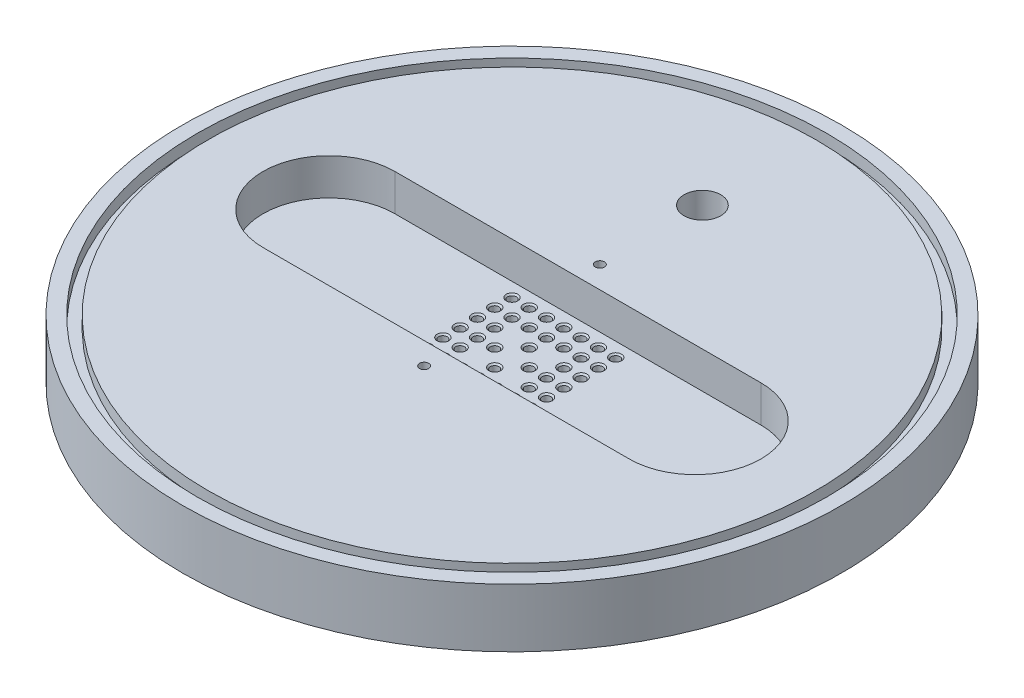
from build123d import *

# Parameters (mm, degrees)
SKETCH1_R                               = 57.15
BILLET_DEPTH                            = 10.16
KEROSENE_WELL_DEPTH                     = 6.35
FIRST_KEROSENE_OUTLET_REACH             = 83.458
SKETCH4_R                               = 0.7493
BOTTOM_NEEDLE_CHAMFER_SIZE              = 0.254
LPATTERN1_COUNT                         = 7
LPATTERN1_PITCH                         = 2.9972
LPATTERN1_COUNT_DIR2                    = 7
LPATTERN1_PITCH_DIR2                    = 2.9972
BOTTOM_NEEDLE_CHAMFER_OF_LPATTERN1_SIZE = 0.254
SKETCH13_R                              = 0.79375
DOWEL_HOLES_DEPTH                       = 3.175
MANIFOLD_HOLE_REACH                     = 83.458
SKETCH14_R                              = 3.175
SKETCH15_R                              = 56.515
SKETCH15_R_2                            = 54.61
CHAMBER_O_RING_DEPTH                    = 2.032
CUT_EXTRUDE4_START                      = -2.032
SKETCH16_R                              = 54.61
SKETCH16_R_2                            = 52.705
CUT_EXTRUDE4_DEPTH                      = 2.032


with BuildPart() as part:
    # Sketch1 → Billet (new body)
    with BuildSketch(Plane(origin=(0, 0, 0), x_dir=(1, 0, 0), z_dir=(0, 1, 0))):
        Circle(SKETCH1_R)
    extrude(amount=-BILLET_DEPTH)

    # Sketch2 → Kerosene Well (cut)
    with BuildSketch(Plane(origin=(0, 0, 0), x_dir=(1, 0, 0), z_dir=(0, 1, 0))):
        with BuildLine():
            Line((-31.75, 11.43), (31.75, 11.43))
            ThreePointArc((31.75, 11.43), (43.18, 0), (31.75, -11.43))
            Line((31.75, -11.43), (-31.75, -11.43))
            ThreePointArc((-31.75, -11.43), (-43.18, 0), (-31.75, 11.43))
        make_face()
    extrude(amount=-KEROSENE_WELL_DEPTH, mode=Mode.SUBTRACT)

    # Sketch4 → First Kerosene Outlet (cut, up to next)
    with BuildSketch(Plane(origin=(0, -10.16, 0), x_dir=(1, 0, 0), z_dir=(0, 1, 0)), mode=Mode.PRIVATE) as first_kerosene_outlet_sk1:
        with Locations((8.9916, 8.9916)):
            Circle(SKETCH4_R)
    first_kerosene_outlet_tool1 = extrude(first_kerosene_outlet_sk1.sketch, amount=FIRST_KEROSENE_OUTLET_REACH, mode=Mode.PRIVATE) & part.part
    first_kerosene_outlet = first_kerosene_outlet_tool1.solids().sort_by_distance((8.9916, -10.16, -8.9916))[0]
    add(first_kerosene_outlet, mode=Mode.SUBTRACT)

    # Bottom Needle Chamfer
    bottom_needle_chamfer_edges = [part.edges().sort_by_distance(p)[0] for p in [
        (8.2423, -6.35, -8.9916),
    ]]
    chamfer(bottom_needle_chamfer_edges, length=BOTTOM_NEEDLE_CHAMFER_SIZE)

    # LPattern1: First Kerosene Outlet 7 × 7, 5 skipped
    with Locations(*[(-j * LPATTERN1_PITCH_DIR2, 0, i * LPATTERN1_PITCH) for i in range(LPATTERN1_COUNT) for j in range(LPATTERN1_COUNT_DIR2) if (i, j) not in ((0, 0), (2, 2), (2, 4), (3, 3), (4, 2), (4, 4))]):
        add(first_kerosene_outlet, mode=Mode.SUBTRACT)

    # Bottom Needle Chamfer of LPattern1
    bottom_needle_chamfer_of_lpattern1_edges = [part.edges().sort_by_distance(p)[0] for p in [
        (5.2451, -6.35, -8.9916),
        (2.2479, -6.35, -8.9916),
        (-0.7493, -6.35, -8.9916),
        (-3.7465, -6.35, -8.9916),
        (-6.7437, -6.35, -8.9916),
        (-9.7409, -6.35, -8.9916),
        (8.2423, -6.35, -5.9944),
        (5.2451, -6.35, -5.9944),
        (2.2479, -6.35, -5.9944),
        (-0.7493, -6.35, -5.9944),
        (-3.7465, -6.35, -5.9944),
        (-6.7437, -6.35, -5.9944),
        (-9.7409, -6.35, -5.9944),
        (8.2423, -6.35, -2.9972),
        (5.2451, -6.35, -2.9972),
        (-0.7493, -6.35, -2.9972),
        (-6.7437, -6.35, -2.9972),
        (-9.7409, -6.35, -2.9972),
        (8.2423, -6.35, 0),
        (5.2451, -6.35, 0),
        (2.2479, -6.35, 0),
        (-3.7465, -6.35, 0),
        (-6.7437, -6.35, 0),
        (-9.7409, -6.35, 0),
        (8.2423, -6.35, 2.9972),
        (5.2451, -6.35, 2.9972),
        (-0.7493, -6.35, 2.9972),
        (-6.7437, -6.35, 2.9972),
        (-9.7409, -6.35, 2.9972),
        (8.2423, -6.35, 5.9944),
        (5.2451, -6.35, 5.9944),
        (2.2479, -6.35, 5.9944),
        (-0.7493, -6.35, 5.9944),
        (-3.7465, -6.35, 5.9944),
        (-6.7437, -6.35, 5.9944),
        (-9.7409, -6.35, 5.9944),
        (8.2423, -6.35, 8.9916),
        (5.2451, -6.35, 8.9916),
        (2.2479, -6.35, 8.9916),
        (-0.7493, -6.35, 8.9916),
        (-3.7465, -6.35, 8.9916),
        (-6.7437, -6.35, 8.9916),
        (-9.7409, -6.35, 8.9916),
    ]]
    chamfer(bottom_needle_chamfer_of_lpattern1_edges, length=BOTTOM_NEEDLE_CHAMFER_OF_LPATTERN1_SIZE)

    # Sketch13 → Dowel Holes (cut)
    with BuildSketch(Plane(origin=(0, 0, 0), x_dir=(1, 0, 0), z_dir=(0, 1, 0))):
        with Locations((0, 15.24)):
            Circle(SKETCH13_R)
        with Locations((0, -15.24)):
            Circle(SKETCH13_R)
    extrude(amount=-DOWEL_HOLES_DEPTH, mode=Mode.SUBTRACT)

    # Sketch14 → Manifold Hole (cut, up to next)
    with BuildSketch(Plane(origin=(0, 0, 0), x_dir=(1, 0, 0), z_dir=(0, 1, 0)), mode=Mode.PRIVATE) as manifold_hole_sk1:
        with Locations((0, 33.02)):
            Circle(SKETCH14_R)
    manifold_hole_tool1 = extrude(manifold_hole_sk1.sketch, amount=-MANIFOLD_HOLE_REACH, mode=Mode.PRIVATE) & part.part
    add(manifold_hole_tool1.solids().sort_by_distance((0, 0, -33.02))[0], mode=Mode.SUBTRACT)

    # Sketch15 → Chamber O Ring (cut)
    with BuildSketch(Plane(origin=(0, -10.16, 0), x_dir=(1, 0, 0), z_dir=(0, 1, 0))):
        Circle(SKETCH15_R)
        Circle(SKETCH15_R_2, mode=Mode.SUBTRACT)
    extrude(amount=CHAMBER_O_RING_DEPTH, mode=Mode.SUBTRACT)

    # Sketch16 → Cut-Extrude4 (cut)
    with BuildSketch(Plane(origin=(0, 0, 0), x_dir=(1, 0, 0), z_dir=(0, 1, 0)).offset(CUT_EXTRUDE4_START)):
        Circle(SKETCH16_R)
        Circle(SKETCH16_R_2, mode=Mode.SUBTRACT)
    extrude(amount=CUT_EXTRUDE4_DEPTH, mode=Mode.SUBTRACT)


solid = part.part
